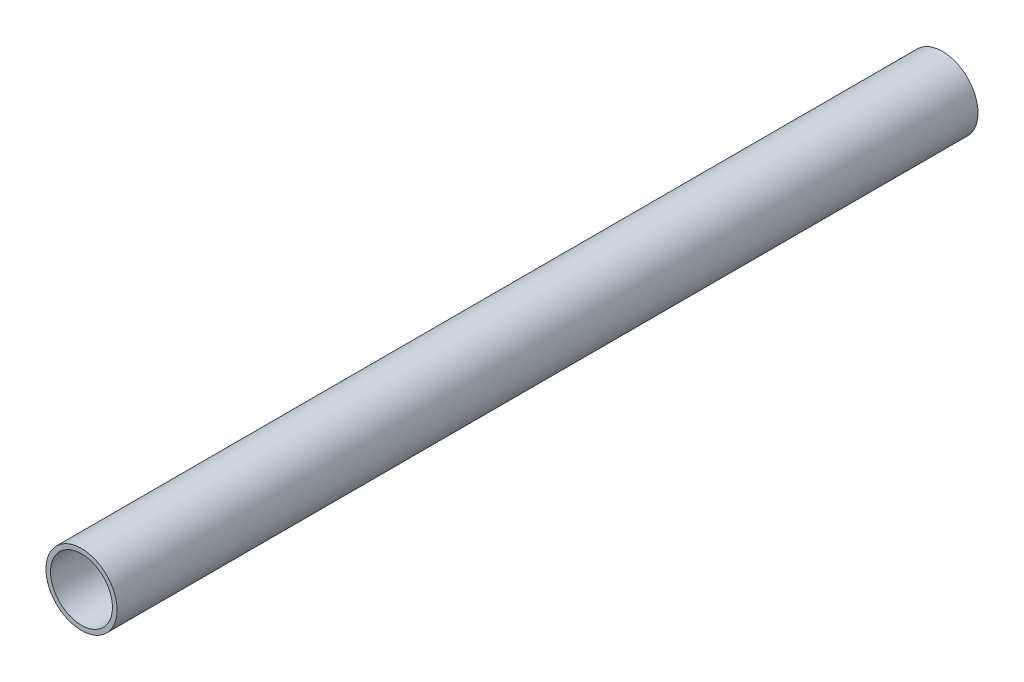
from build123d import *

# Parameters (mm, degrees)
SKETCH1_R           = 30.1625
SKETCH1_R_2         = 26.2509
BOSS_EXTRUDE1_DEPTH = 730.25


with BuildPart() as part:
    # Sketch1 → Boss-Extrude1 (new body)
    with BuildSketch(Plane.XY):
        Circle(SKETCH1_R)
        Circle(SKETCH1_R_2, mode=Mode.SUBTRACT)
    extrude(amount=BOSS_EXTRUDE1_DEPTH)


solid = part.part
